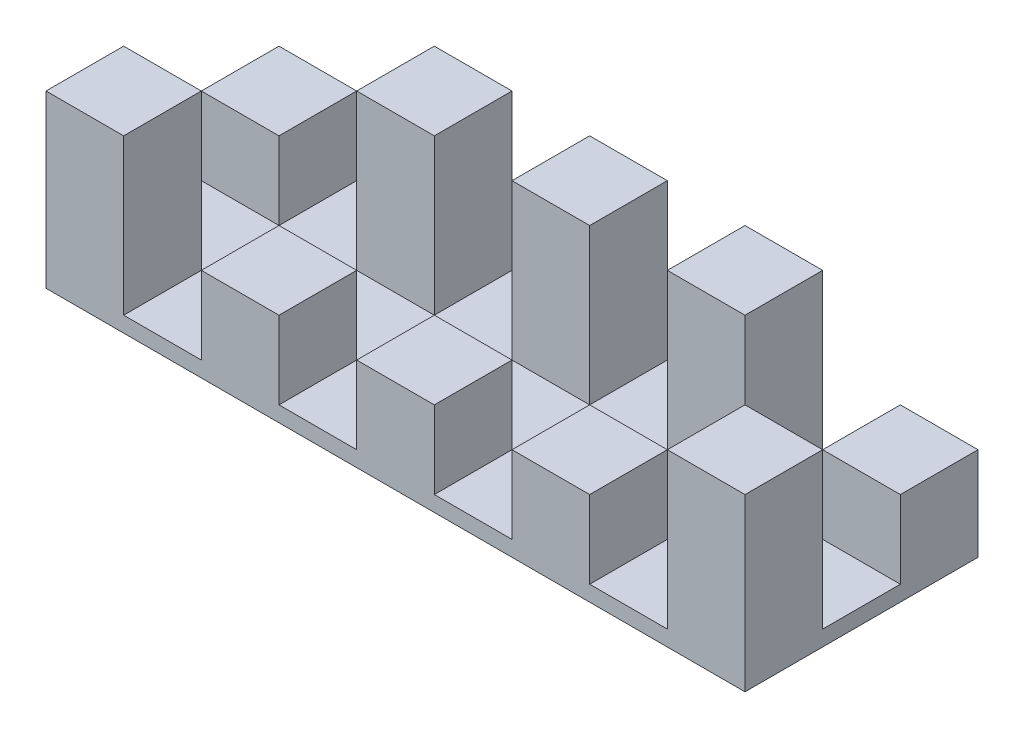
from build123d import *

# Parameters (mm, degrees)
SKETCH1_W           = 450
SKETCH1_H           = 150
BOSS_EXTRUDE1_DEPTH = 10
SKETCH2_W           = 50
SKETCH2_H           = 50
BOSS_EXTRUDE2_DEPTH = 50
SKETCH5_W           = 50
SKETCH5_H           = 50
BOSS_EXTRUDE3_DEPTH = 100


with BuildPart() as part:
    # Sketch1 → Boss-Extrude1 (new body)
    with BuildSketch(Plane(origin=(0, 0, 0), x_dir=(1, 0, 0), z_dir=(0, 1, 0))):
        with Locations((225, 75)):
            Rectangle(SKETCH1_W, SKETCH1_H)
    extrude(amount=BOSS_EXTRUDE1_DEPTH)

    # Sketch2 → Boss-Extrude2 (add)
    with BuildSketch(Plane(origin=(0, 10, 0), x_dir=(1, 0, 0), z_dir=(0, 1, 0))):
        with Locations((125, 25)):
            Rectangle(SKETCH2_W, SKETCH2_H)
        with Locations((225, 25)):
            Rectangle(SKETCH2_W, SKETCH2_H)
        with Locations((325, 25)):
            Rectangle(SKETCH2_W, SKETCH2_H)
        with Locations((425, 125)):
            Rectangle(SKETCH2_W, SKETCH2_H)
        with Locations((25, 125)):
            Rectangle(SKETCH2_W, SKETCH2_H)
    extrude(amount=BOSS_EXTRUDE2_DEPTH)

    # Sketch5 → Boss-Extrude3 (add)
    with BuildSketch(Plane(origin=(0, 10, 0), x_dir=(1, 0, 0), z_dir=(0, 1, 0))):
        with Locations((25, 25)):
            Rectangle(SKETCH5_W, SKETCH5_H)
        with Locations((125, 125)):
            Rectangle(SKETCH5_W, SKETCH5_H)
        with Locations((225, 125)):
            Rectangle(SKETCH5_W, SKETCH5_H)
        with Locations((425, 25)):
            Rectangle(SKETCH5_W, SKETCH5_H)
        with Locations((325, 125)):
            Rectangle(SKETCH5_W, SKETCH5_H)
    extrude(amount=BOSS_EXTRUDE3_DEPTH)


solid = part.part
